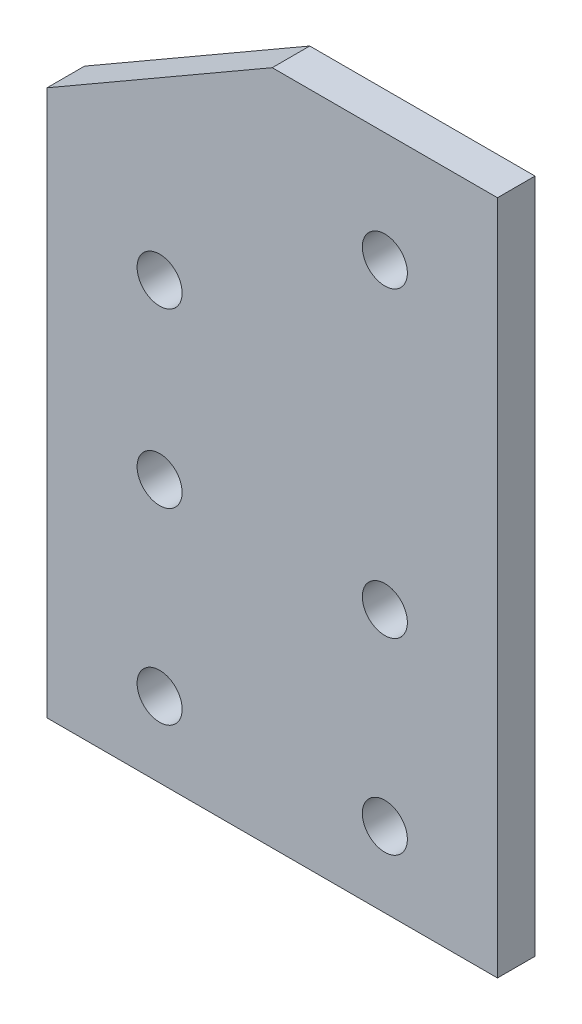
from build123d import *

# Parameters (mm, degrees)
SKETCH1_R           = 3.81
BOSS_EXTRUDE1_DEPTH = 6.35


with BuildPart() as part:
    # Sketch1 → Boss-Extrude1 (new body)
    with BuildSketch(Plane.XY):
        Polygon((0, 92.302954744), (38.1, 114.3), (76.2, 114.3), (76.2, 0), (0, 0), align=None)
        with Locations((19.05, 73.66)):
            Circle(SKETCH1_R, mode=Mode.SUBTRACT)
        with Locations((57.15, 95.657045256)):
            Circle(SKETCH1_R, mode=Mode.SUBTRACT)
        with Locations((19.05, 44.45)):
            Circle(SKETCH1_R, mode=Mode.SUBTRACT)
        with Locations((19.05, 12.7)):
            Circle(SKETCH1_R, mode=Mode.SUBTRACT)
        with Locations((57.15, 44.45)):
            Circle(SKETCH1_R, mode=Mode.SUBTRACT)
        with Locations((57.15, 12.7)):
            Circle(SKETCH1_R, mode=Mode.SUBTRACT)
    extrude(amount=BOSS_EXTRUDE1_DEPTH)


solid = part.part
